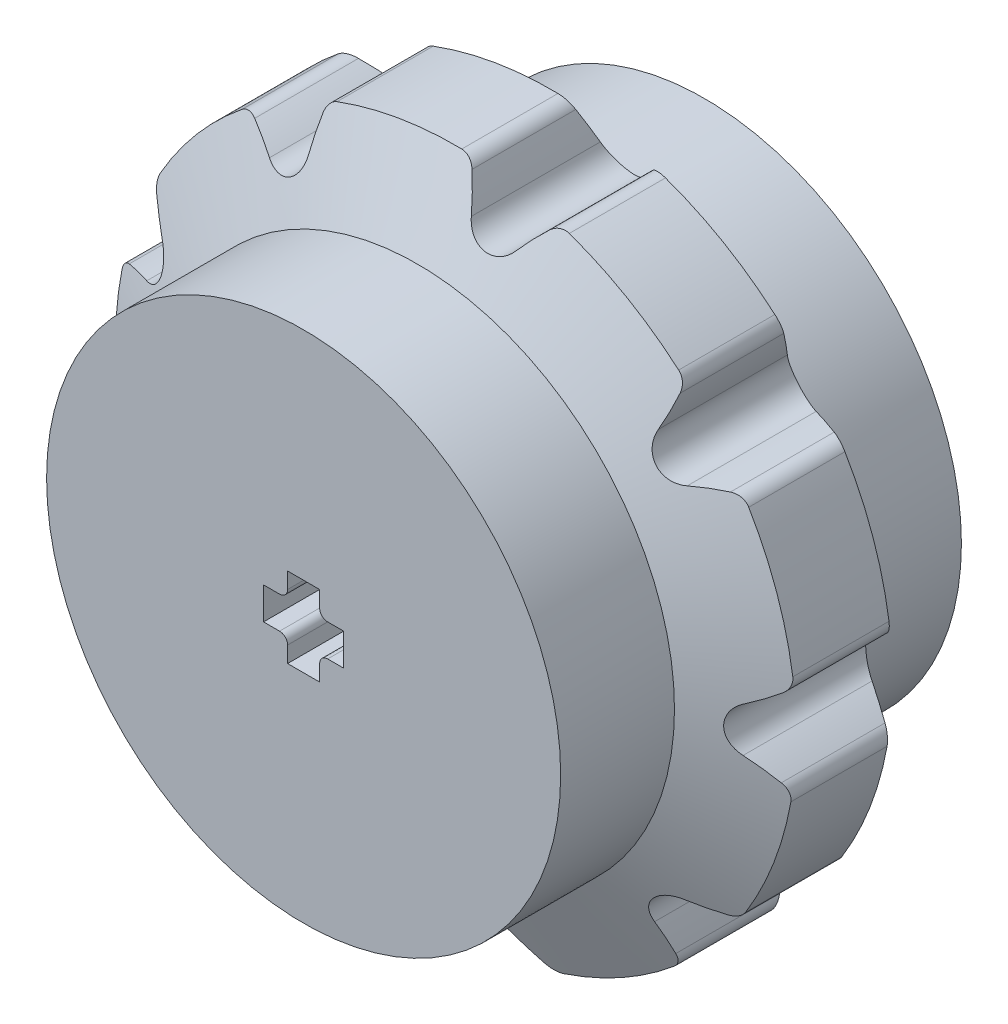
from build123d import *

# Parameters (mm, degrees)
CUT_EXTRUDE1_DEPTH  = 40.075672544
CIRPATTERN1_COUNT   = 10
CIRPATTERN1_ANGLE   = 359
SKETCH7_R           = 3
BOSS_EXTRUDE1_DEPTH = 25


with BuildPart() as part:
    # Sketch1 → Revolve1 (revolve)
    with BuildSketch(Plane(origin=(0, 0, 0), x_dir=(1, 0, 0), z_dir=(0, 1, 0)), mode=Mode.PRIVATE) as revolve1_sk:
        Polygon((3, 12.5), (16.035679701, 12.5), (16.035679701, 5.4), (21.235679701, 3), (21.235679701, -3), (16.035679701, -5.4), (16.035679701, -12.5), (12.035679701, -12.5), (10, -2.5), (3, -2.5), align=None)
    revolve(revolve1_sk.sketch.rotate(Axis((0, 0, 0), (0, 0, 1)), 180), axis=Axis((0, 0, 0), (0, 0, 1)))

    # Sketch3 → Cut-Extrude1 (cut, through all)
    with BuildSketch(Plane.XY.offset(12.5)):
        with BuildLine():
            ThreePointArc((20.960566803, 3.407158885), (21.235679701, 0), (20.960566803, -3.407158885))
            ThreePointArc((20.960566803, -3.407158885), (20.902304198, -2.87608782), (20.578938361, -2.450804923))
            ThreePointArc((20.578938361, -2.450804923), (19.791680516, -1.89675335), (18.965580661, -1.402479044))
            ThreePointArc((18.965580661, -1.402479044), (18.135679701, 0), (18.965580661, 1.402479044))
            ThreePointArc((18.965580661, 1.402479044), (19.791680516, 1.89675335), (20.578938361, 2.450804923))
            ThreePointArc((20.578938361, 2.450804923), (20.902304198, 2.87608782), (20.960566803, 3.407158885))
        make_face()
    cut_extrude1 = extrude(amount=-CUT_EXTRUDE1_DEPTH, mode=Mode.SUBTRACT)

    # Sketch6 → Revolve5 (revolve)
    with BuildSketch(Plane.ZY, mode=Mode.PRIVATE) as revolve5_sk:
        Polygon((12.5, 3), (12.5, 12.035679701), (12.5, 16.035679701), (5.4, 16.035679701), (3, 21.235679701), (-3, 21.235679701), (-5.4, 16.035679701), (-12.5, 16.035679701), (-12.5, 3), align=None)
    revolve(revolve5_sk.sketch.rotate(Axis((0, 0, -12.5), (0, 0, 1)), 90), axis=Axis((0, 0, -12.5), (0, 0, 1)))

    # CirPattern1: Cut-Extrude1 ×10 about axis
    cirpattern1_axis = Axis((0, 0, -80.9), (0, 0, 1))
    for i in range(1, CIRPATTERN1_COUNT):
        add(cut_extrude1.rotate(cirpattern1_axis, i * CIRPATTERN1_ANGLE / (CIRPATTERN1_COUNT - 1)), mode=Mode.SUBTRACT)

    # Sketch7 → Boss-Extrude1 (add)
    with BuildSketch(Plane(origin=(0, 0, -12.5), x_dir=(-1, 0, 0), z_dir=(0, 0, -1))):
        Circle(SKETCH7_R)
        with BuildLine():
            Line((2.5, 0), (2.5, -1))
            Line((2.5, -1), (1.5, -1))
            ThreePointArc((1.5, -1), (1.146446609, -1.146446609), (1, -1.5))
            Line((1, -1.5), (1, -2.5))
            Line((1, -2.5), (0, -2.5))
            Line((0, -2.5), (-1, -2.5))
            Line((-1, -2.5), (-1, -1.5))
            ThreePointArc((-1, -1.5), (-1.146446609, -1.146446609), (-1.5, -1))
            Line((-1.5, -1), (-2.5, -1))
            Line((-2.5, -1), (-2.5, 0))
            Line((-2.5, 0), (-2.5, 1))
            Line((-2.5, 1), (-1.5, 1))
            ThreePointArc((-1.5, 1), (-1.146446609, 1.146446609), (-1, 1.5))
            Line((-1, 1.5), (-1, 2.5))
            Line((-1, 2.5), (0, 2.5))
            Line((0, 2.5), (1, 2.5))
            Line((1, 2.5), (1, 1.5))
            ThreePointArc((1, 1.5), (1.146446609, 1.146446609), (1.5, 1))
            Line((1.5, 1), (2.5, 1))
            Line((2.5, 1), (2.5, 0))
        make_face(mode=Mode.SUBTRACT)
    extrude(amount=-BOSS_EXTRUDE1_DEPTH)


solid = part.part
